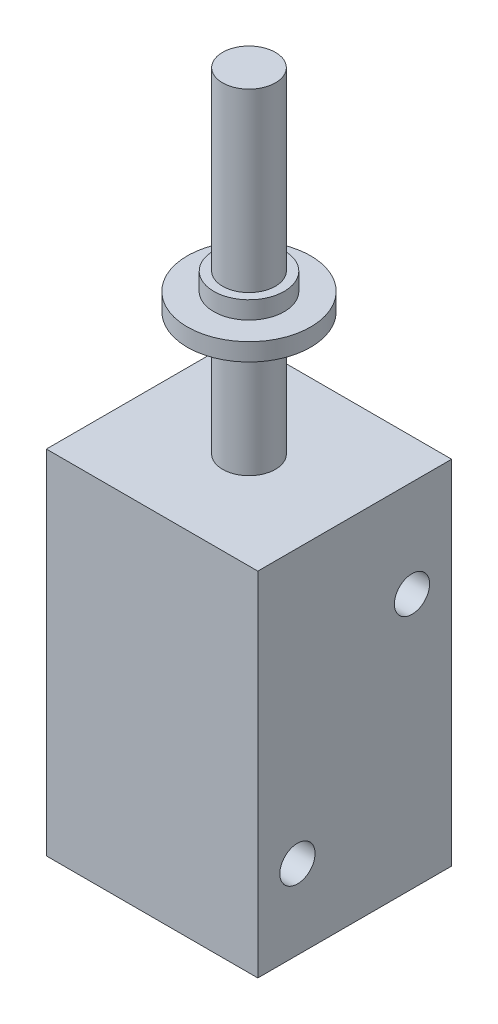
from build123d import *

# Parameters (mm, degrees)
SKETCH1_W           = 12
SKETCH1_H           = 11
BOSS_EXTRUDE1_DEPTH = 20
SKETCH2_R           = 1.5
BOSS_EXTRUDE2_DEPTH = 19
SKETCH3_R           = 3.5
BOSS_EXTRUDE3_DEPTH = 1
SKETCH4_R           = 2
BOSS_EXTRUDE4_DEPTH = 1
SKETCH5_R           = 1
CUT_EXTRUDE1_DEPTH  = 12


with BuildPart() as part:
    # Sketch1 → Boss-Extrude1 (new body)
    with BuildSketch(Plane(origin=(0, 0, 0), x_dir=(1, 0, 0), z_dir=(0, 1, 0))):
        with Locations((6, 5.5)):
            Rectangle(SKETCH1_W, SKETCH1_H)
    extrude(amount=BOSS_EXTRUDE1_DEPTH)

    # Sketch2 → Boss-Extrude2 (add)
    with BuildSketch(Plane(origin=(0, 20, 0), x_dir=(1, 0, 0), z_dir=(0, 1, 0))):
        with Locations(Location((6, 5.5, 0), (0, 0, 270))):
            Circle(SKETCH2_R)
    extrude(amount=BOSS_EXTRUDE2_DEPTH)

    # Sketch3 → Boss-Extrude3 (add)
    with BuildSketch(Plane(origin=(0, 27, 0), x_dir=(1, 0, 0), z_dir=(0, 1, 0))):
        with Locations(Location((6, 5.5, 0), (0, 0, 270))):
            Circle(SKETCH3_R)
    extrude(amount=BOSS_EXTRUDE3_DEPTH)

    # Sketch4 → Boss-Extrude4 (add)
    with BuildSketch(Plane(origin=(0, 28, 0), x_dir=(1, 0, 0), z_dir=(0, 1, 0))):
        with Locations(Location((6, 5.5, 0), (0, 0, 270))):
            Circle(SKETCH4_R)
    extrude(amount=BOSS_EXTRUDE4_DEPTH)

    # Sketch5 → Cut-Extrude1 (cut)
    with BuildSketch(Plane(origin=(12, 0, 0), x_dir=(0, 0, -1), z_dir=(1, 0, 0))):
        with Locations((2.25, 4.5)):
            Circle(SKETCH5_R)
        with Locations((8.75, 14.5)):
            Circle(SKETCH5_R)
    extrude(amount=-CUT_EXTRUDE1_DEPTH, mode=Mode.SUBTRACT)


solid = part.part
